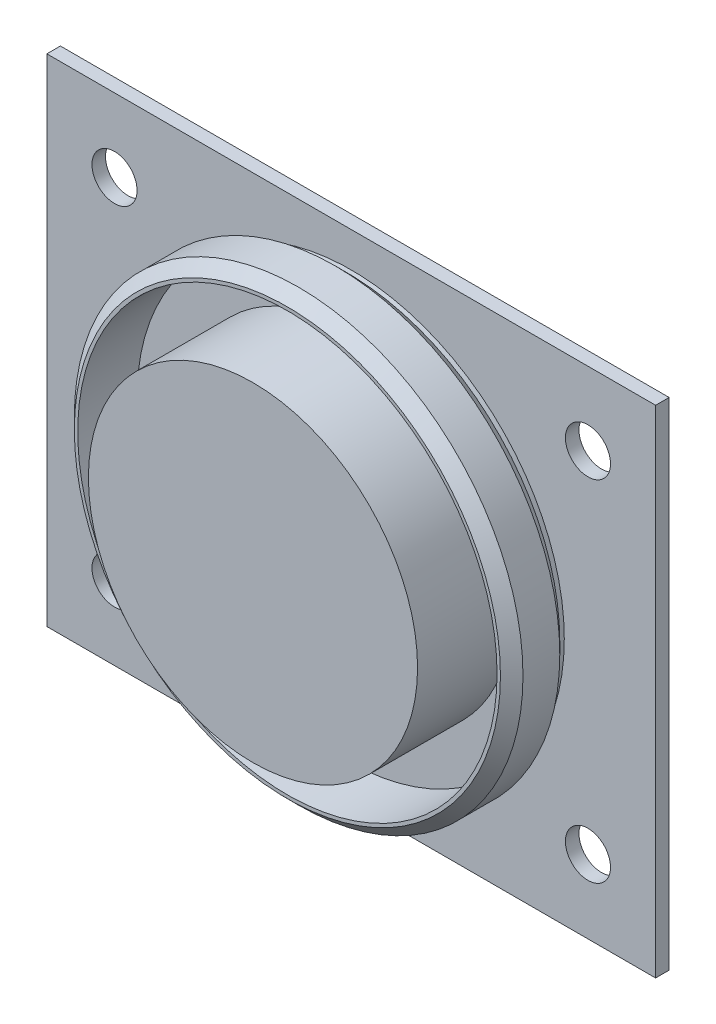
from build123d import *

# Parameters (mm, degrees)
SCHIZZO1_W                   = 135
SCHIZZO1_H                   = 110
SCHIZZO1_R                   = 5
ESTRUSIONE_ESTRUSIONE1_DEPTH = 3


with BuildPart() as part:
    # Schizzo1 → Estrusione-Estrusione1 (new body)
    with BuildSketch(Plane.XY):
        Rectangle(SCHIZZO1_W, SCHIZZO1_H)
        with Locations((-52.5, 38.75)):
            Circle(SCHIZZO1_R, mode=Mode.SUBTRACT)
        with Locations((-52.5, -38.75)):
            Circle(SCHIZZO1_R, mode=Mode.SUBTRACT)
        with Locations((52.5, -38.75)):
            Circle(SCHIZZO1_R, mode=Mode.SUBTRACT)
        with Locations((52.5, 38.75)):
            Circle(SCHIZZO1_R, mode=Mode.SUBTRACT)
    extrude(amount=ESTRUSIONE_ESTRUSIONE1_DEPTH)

    # Schizzo3 → Rivoluzione1 (revolve)
    with BuildSketch(Plane(origin=(0, 0, 0), x_dir=(1, 0, 0), z_dir=(0, 1, 0))):
        Polygon((47.25, -4), (49.75, -6.5), (49.75, -14.66), (47.25, -17.16), (46.5, -17.16), (46.5, -4), (36.5, -4), (36.5, -24.79), (0, -24.79), (0, -4), (0, -3), (47.25, -3), align=None)
    revolve(axis=Axis((0, 0, 4), (0, 0, -1)))


solid = part.part
